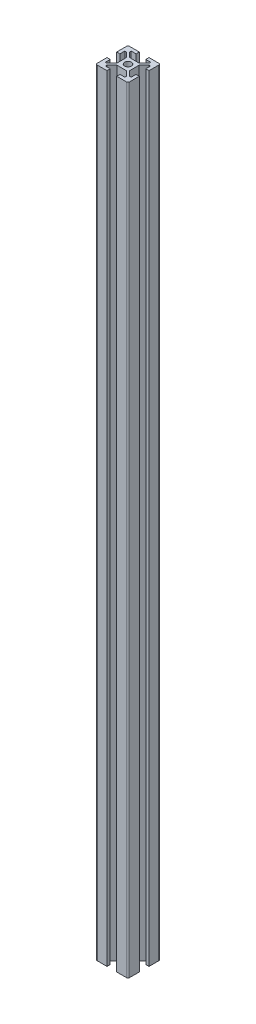
from build123d import *

# Parameters (mm, degrees)
BASE_EXTRUSTION_DEPTH      = 240
BASE_EXTRUSTION_DEPTH_BACK = 240
SKETCH1_R                  = 2.1
CORNERS_R                  = 1


with BuildPart() as part:
    # Sketch1 → Base Extrustion (new, two sides: drawn at the far end of the back side and taken through both)
    with BuildSketch(Plane(origin=(0, 0, 0), x_dir=(1, 0, 0), z_dir=(0, 1, 0)).offset(-BASE_EXTRUSTION_DEPTH_BACK)):
        Polygon((-10, 10), (-3, 10), (-3, 8), (-6, 8), (-6, 7.060660172), (-2.939339828, 4), (2.939339828, 4), (6, 7.060660172), (6, 8), (3, 8), (3, 10), (10, 10), (10, 3), (8, 3), (8, 6), (7.060660172, 6), (4, 2.939339828), (4, -2.939339828), (7.060660172, -6), (8, -6), (8, -3), (10, -3), (10, -10), (3, -10), (3, -8), (6, -8), (6, -7.060660172), (2.939339828, -4), (-2.939339828, -4), (-6, -7.060660172), (-6, -8), (-3, -8), (-3, -10), (-10, -10), (-10, -3), (-8, -3), (-8, -6), (-7.060660172, -6), (-4, -2.939339828), (-4, 2.939339828), (-7.060660172, 6), (-8, 6), (-8, 3), (-10, 3), align=None)
        with Locations(Location((0, 0, 0), (0, 0, 270))):
            Circle(SKETCH1_R, mode=Mode.SUBTRACT)
    extrude(amount=BASE_EXTRUSTION_DEPTH + BASE_EXTRUSTION_DEPTH_BACK)

    # Corners
    corners_edges = [part.edges().sort_by_distance(p)[0] for p in [
        (-10, 0, -10),
        (10, 0, -10),
        (10, 0, 10),
        (-10, 0, 10),
    ]]
    fillet(corners_edges, radius=CORNERS_R)


solid = part.part
